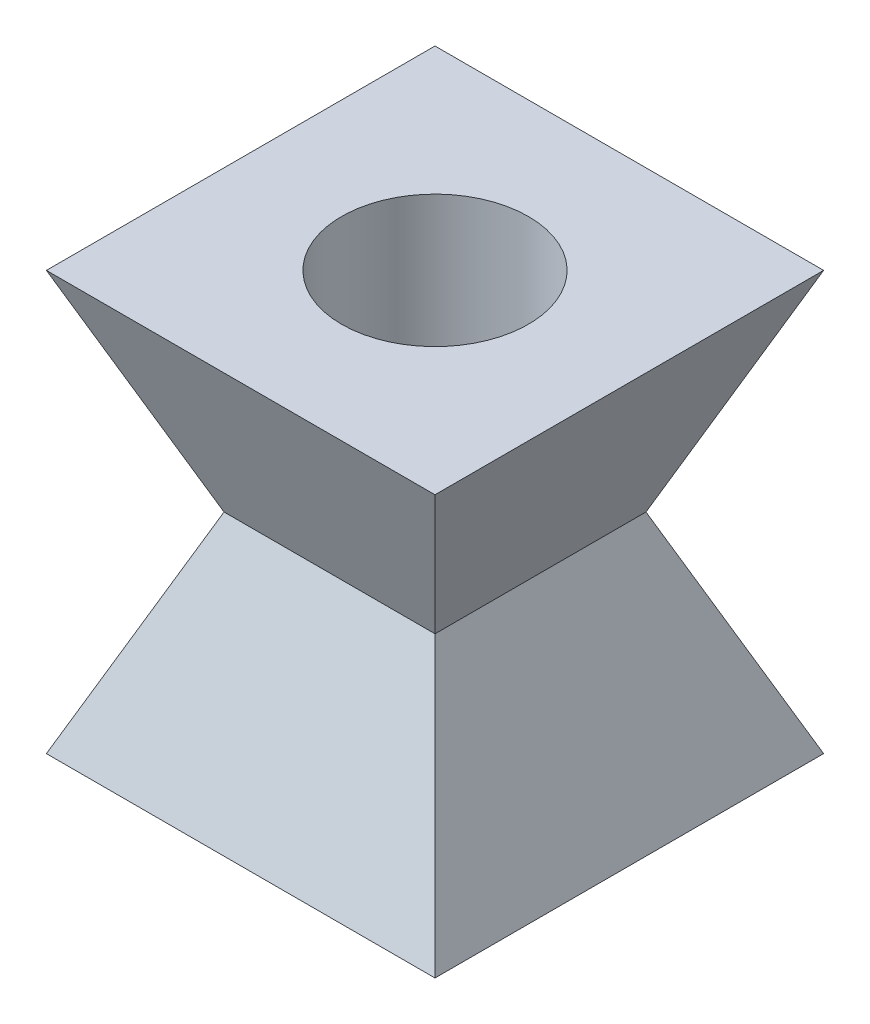
from build123d import *

# Parameters (mm, degrees)
ESQUISSE1_W                  = 104
ESQUISSE1_H                  = 104
BOSS_EXTRU_2_DEPTH           = 56
BOSS_EXTRU_2_DRAFT           = -23
SYM_TRIE1_COPY_1_SKETCH_W    = 104
SYM_TRIE1_COPY_1_SKETCH_H    = 104
SYM_TRIE1_COPY_1_DEPTH       = 56
SYM_TRIE1_COPY_1_DRAFT       = -23
ENL_V_MAT_EXTRU_1_DEPTH      = 134.985073796
ENL_V_MAT_EXTRU_1_DEPTH_BACK = 134.985073796
ESQUISSE2_R                  = 25


with BuildPart() as part:
    # Esquisse1 → Boss.-Extru.2 (with draft: the straight prism first)
    with BuildSketch(Plane(origin=(0, 0, 0), x_dir=(1, 0, 0), z_dir=(0, 1, 0))):
        Rectangle(ESQUISSE1_W, ESQUISSE1_H)
    extrude(amount=-BOSS_EXTRU_2_DEPTH)
    # Boss.-Extru.2: the draft: its side faces are tilted about the plane it starts from
    boss_extru_2_sides = [part.faces().sort_by_distance(p)[0] for p in [
        (-52, -28, 0),
        (0, -28, 52),
        (52, -28, 0),
        (0, -28, -52),
    ]]
    draft(boss_extru_2_sides, Plane(origin=(0, 0, 0), x_dir=(1, 0, 0), z_dir=(0, 1, 0)), BOSS_EXTRU_2_DRAFT)


with BuildPart() as sym_trie1_copy_1_tool:
    # Symétrie1 copy 1 sketch → Symétrie1 copy 1 (with draft: the straight prism first)
    with BuildSketch(Plane.XZ.offset(112)):
        Rectangle(SYM_TRIE1_COPY_1_SKETCH_W, SYM_TRIE1_COPY_1_SKETCH_H)
    extrude(amount=-SYM_TRIE1_COPY_1_DEPTH)
    # Symétrie1 copy 1: the draft: its side faces are tilted about the plane it starts from
    sym_trie1_copy_1_sides = [sym_trie1_copy_1_tool.faces().sort_by_distance(p)[0] for p in [
        (-52, -84, 0),
        (0, -84, 52),
        (52, -84, 0),
        (0, -84, -52),
    ]]
    draft(sym_trie1_copy_1_sides, Plane.XZ.offset(112), SYM_TRIE1_COPY_1_DRAFT)


with BuildPart() as part_1:
    add(part.part)

    # Symétrie1 copy 1: add sym_trie1_copy_1_tool
    add(sym_trie1_copy_1_tool.part)

    # Esquisse2 → Enlèv. mat.-Extru.1 (cut, two sides: drawn at the far end of the back side and taken through both)
    with BuildSketch(Plane(origin=(0, 0, 0), x_dir=(1, 0, 0), z_dir=(0, 1, 0)).offset(-ENL_V_MAT_EXTRU_1_DEPTH_BACK)):
        with Locations(Location((0, 0, 0), (0, 0, 270))):
            Circle(ESQUISSE2_R)
    extrude(amount=ENL_V_MAT_EXTRU_1_DEPTH + ENL_V_MAT_EXTRU_1_DEPTH_BACK, mode=Mode.SUBTRACT)


solid = part_1.part
